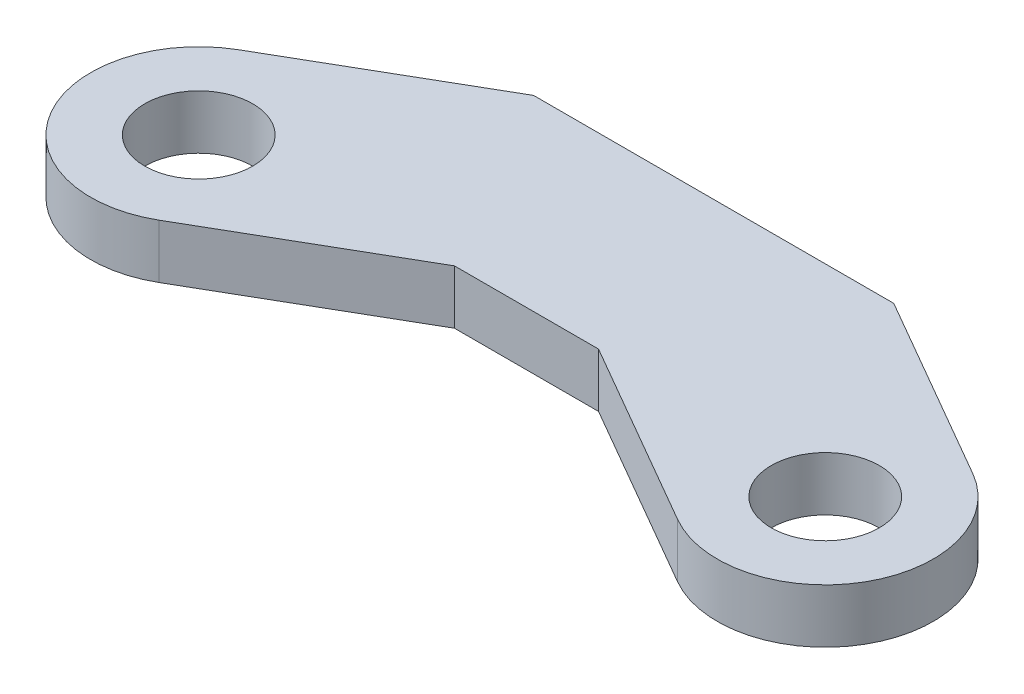
from build123d import *

# Parameters (mm, degrees)
SKETCH1_R           = 1.5
BOSS_EXTRUDE1_DEPTH = 1.5


with BuildPart() as part:
    # Sketch1 → Boss-Extrude1 (new body)
    with BuildSketch(Plane(origin=(0, 0, 0), x_dir=(1, 0, 0), z_dir=(0, 1, 0))):
        with BuildLine():
            Line((-8.464101615, -2), (-13.660254038, -5))
            ThreePointArc((-13.660254038, -5), (-14.758330249, -9.098076211), (-10.660254038, -10.196152423))
            Line((-10.660254038, -10.196152423), (-5.464101615, -7.196152423))
            Line((-5.464101615, -7.196152423), (-1.464101615, -7.196152423))
            Line((-1.464101615, -7.196152423), (3.732050808, -10.196152423))
            ThreePointArc((3.732050808, -10.196152423), (7.830127019, -9.098076211), (6.732050808, -5))
            Line((6.732050808, -5), (1.535898385, -2))
            Line((1.535898385, -2), (-8.464101615, -2))
        make_face()
        with Locations(Location((-12.160254038, -7.598076211, 0), (0, 0, 270))):
            Circle(SKETCH1_R, mode=Mode.SUBTRACT)
        with Locations(Location((5.232050808, -7.598076211, 0), (0, 0, 90))):
            Circle(SKETCH1_R, mode=Mode.SUBTRACT)
    extrude(amount=BOSS_EXTRUDE1_DEPTH)


solid = part.part
